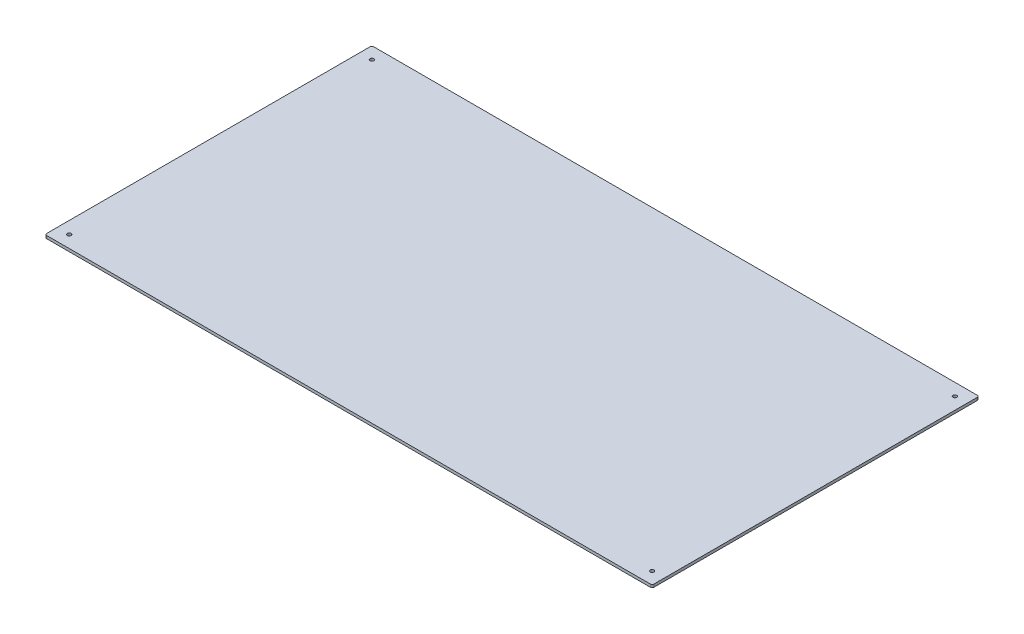
from build123d import *

# Parameters (mm, degrees)
SKETCH_1_R      = 2
EXTRUDE_1_DEPTH = 3


with BuildPart() as part:
    # 草图1 → 凸台-拉伸1 (new body)
    with BuildSketch(Plane(origin=(0, 0, 0), x_dir=(1, 0, 0), z_dir=(0, 1, 0))):
        with BuildLine():
            Line((2, 0), (648, 0))
            ThreePointArc((648, 0), (649.414213562, 0.585786438), (650, 2))
            Line((650, 2), (650, 348))
            ThreePointArc((650, 348), (649.414213562, 349.414213562), (648, 350))
            Line((648, 350), (2, 350))
            ThreePointArc((2, 350), (0.585786438, 349.414213562), (0, 348))
            Line((0, 348), (0, 2))
            ThreePointArc((0, 2), (0.585786438, 0.585786438), (2, 0))
        make_face()
        with Locations(Location((13, 13, 0), (0, 0, 270))):
            Circle(SKETCH_1_R, mode=Mode.SUBTRACT)
        with Locations(Location((637, 13, 0), (0, 0, 270))):
            Circle(SKETCH_1_R, mode=Mode.SUBTRACT)
        with Locations(Location((13, 337, 0), (0, 0, 270))):
            Circle(SKETCH_1_R, mode=Mode.SUBTRACT)
        with Locations(Location((637, 337, 0), (0, 0, 270))):
            Circle(SKETCH_1_R, mode=Mode.SUBTRACT)
    extrude(amount=EXTRUDE_1_DEPTH)


solid = part.part
